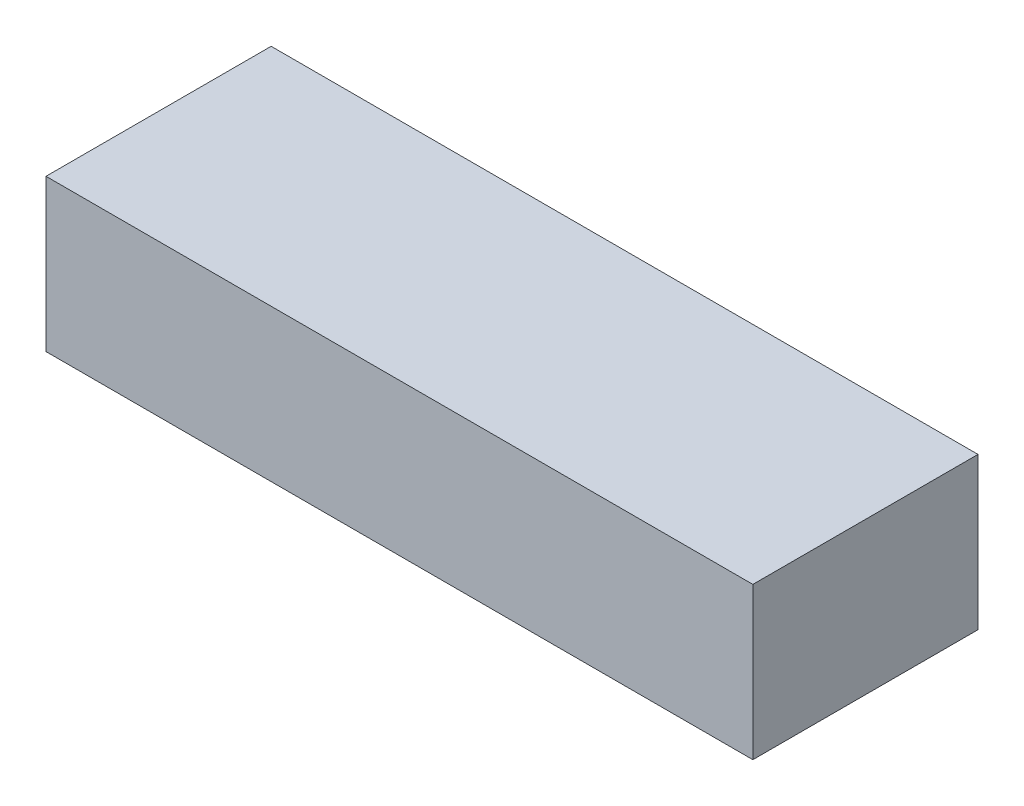
from build123d import *

# Parameters (mm, degrees)
SKETCH1_W           = 135
SKETCH1_H           = 43
BOSS_EXTRUDE1_DEPTH = 29


with BuildPart() as part:
    # Sketch1 → Boss-Extrude1 (new body)
    with BuildSketch(Plane(origin=(0, 0, 0), x_dir=(1, 0, 0), z_dir=(0, 1, 0))):
        Rectangle(SKETCH1_W, SKETCH1_H)
    extrude(amount=BOSS_EXTRUDE1_DEPTH)


solid = part.part
